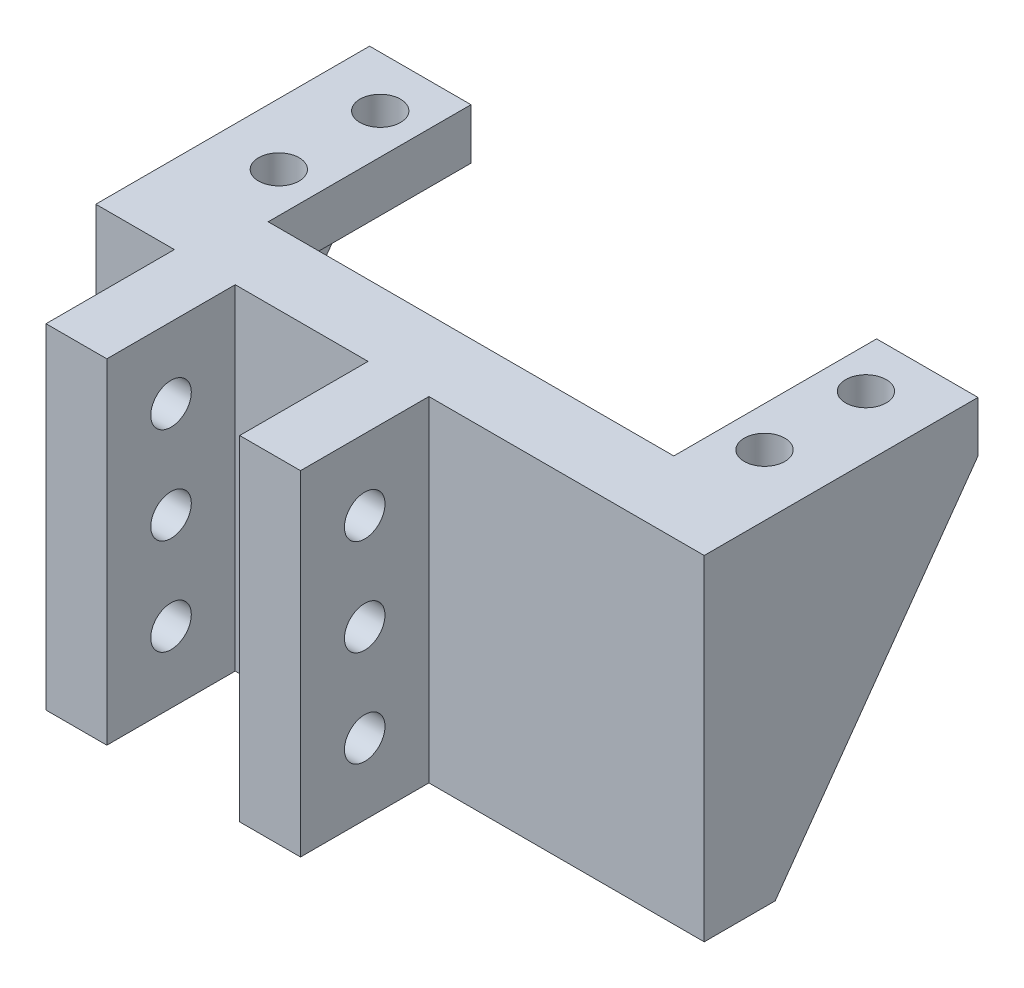
from build123d import *

# Parameters (mm, degrees)
SKETCH2_W               = 8
SKETCH2_H               = 20
SKETCH2_W_2             = 11.75
SKETCH2_H_2             = 12.66
BOSS_EXTRUDE1_DEPTH     = 5
SKETCH3_W               = 13.1
SKETCH3_H               = 7
BOSS_EXTRUDE2_DEPTH     = 28
SKETCH4_W               = 5.75
SKETCH4_H               = 12.66
CUT_EXTRUDE1_DEPTH      = 62.587336361
SKETCH5_R               = 2
CUT_EXTRUDE2_DEPTH      = 61.902073035
SKETCH6_R               = 2
CUT_EXTRUDE3_DEPTH      = 60.059292241
SKETCH7_W               = 7
SKETCH7_H               = 28
BOSS_EXTRUDE3_DEPTH     = 19.4
SKETCH8_W               = 27
SKETCH8_H               = 33
BOSS_EXTRUDE4_DEPTH     = 2
SKETCH9_W               = 27
SKETCH9_H               = 33
BOSS_EXTRUDE5_DEPTH     = 2
CUT_EXTRUDE4_DEPTH      = 68.4388612
CUT_EXTRUDE4_DEPTH_BACK = 68.4388612


with BuildPart() as part:
    # Sketch2 → Boss-Extrude1 (new body)
    with BuildSketch(Plane(origin=(0, 0, 0), x_dir=(1, 0, 0), z_dir=(0, 1, 0))):
        with Locations((-4, 10)):
            Rectangle(SKETCH2_W, SKETCH2_H)
        Polygon((40, 0), (0, 0), (-8, 0), (-8, -7), (3.75, -7), (16.85, -7), (28.6, -7), (48, -7), (48, 0), align=None)
        with Locations((-2.125, -13.33)):
            Rectangle(SKETCH2_W_2, SKETCH2_H_2)
        with Locations((22.725, -13.33)):
            Rectangle(SKETCH2_W_2, SKETCH2_H_2)
        with Locations((44, 10)):
            Rectangle(SKETCH2_W, SKETCH2_H)
    extrude(amount=BOSS_EXTRUDE1_DEPTH)

    # Sketch3 → Boss-Extrude2 (add)
    with BuildSketch(Plane.XZ):
        Polygon((3.75, 19.66), (-8, 19.66), (-8, 0), (0, 0), (3.75, 0), (3.75, 7), align=None)
        with Locations((10.3, 3.5)):
            Rectangle(SKETCH3_W, SKETCH3_H)
        Polygon((16.85, 19.66), (16.85, 7), (16.85, 0), (28.6, 0), (28.6, 7), (28.6, 19.66), align=None)
    extrude(amount=BOSS_EXTRUDE2_DEPTH)

    # Sketch4 → Cut-Extrude1 (cut, through all)
    with BuildSketch(Plane.XZ.offset(28)):
        with Locations((-5.125, 13.33)):
            Rectangle(SKETCH4_W, SKETCH4_H)
        with Locations((25.725, 13.33)):
            Rectangle(SKETCH4_W, SKETCH4_H)
    extrude(amount=-CUT_EXTRUDE1_DEPTH, mode=Mode.SUBTRACT)

    # Sketch5 → Cut-Extrude2 (cut, through all)
    with BuildSketch(Plane.ZY.offset(2.25)):
        with Locations((13.33, -2)):
            Circle(SKETCH5_R)
        with Locations((13.33, -21)):
            Circle(SKETCH5_R)
        with Locations((13.33, -11.5)):
            Circle(SKETCH5_R)
    extrude(amount=-CUT_EXTRUDE2_DEPTH, mode=Mode.SUBTRACT)

    # Sketch6 → Cut-Extrude3 (cut, through all)
    with BuildSketch(Plane.XZ):
        with Locations(Location((43.95, -5, 0), (0, 0, 270))):
            Circle(SKETCH6_R)
        with Locations(Location((43.95, -15, 0), (0, 0, 270))):
            Circle(SKETCH6_R)
        with Locations(Location((-3.95, -5, 0), (0, 0, 270))):
            Circle(SKETCH6_R)
        with Locations(Location((-3.95, -15, 0), (0, 0, 270))):
            Circle(SKETCH6_R)
    extrude(amount=-CUT_EXTRUDE3_DEPTH, mode=Mode.SUBTRACT)

    # Sketch7 → Boss-Extrude3 (add)
    with BuildSketch(Plane(origin=(28.6, 0, 0), x_dir=(0, 0, -1), z_dir=(1, 0, 0))):
        with Locations((-3.5, -14)):
            Rectangle(SKETCH7_W, SKETCH7_H)
    extrude(amount=BOSS_EXTRUDE3_DEPTH)

    # Sketch8 → Boss-Extrude4 (add)
    with BuildSketch(Plane(origin=(48, 0, 0), x_dir=(0, 0, -1), z_dir=(1, 0, 0))):
        with Locations((6.5, -11.5)):
            Rectangle(SKETCH8_W, SKETCH8_H)
    extrude(amount=BOSS_EXTRUDE4_DEPTH)

    # Sketch9 → Boss-Extrude5 (add)
    with BuildSketch(Plane.ZY.offset(8)):
        with Locations((-6.5, -11.5)):
            Rectangle(SKETCH9_W, SKETCH9_H)
    extrude(amount=BOSS_EXTRUDE5_DEPTH)

    # Sketch10 → Cut-Extrude4 (cut, two sides: drawn at the far end of the back side and taken through both)
    with BuildSketch(Plane.ZY.offset(-48).offset(-CUT_EXTRUDE4_DEPTH_BACK)):
        Polygon((-20, 0), (0, -28), (-20, -28), align=None)
    extrude(amount=CUT_EXTRUDE4_DEPTH + CUT_EXTRUDE4_DEPTH_BACK, mode=Mode.SUBTRACT)


solid = part.part
